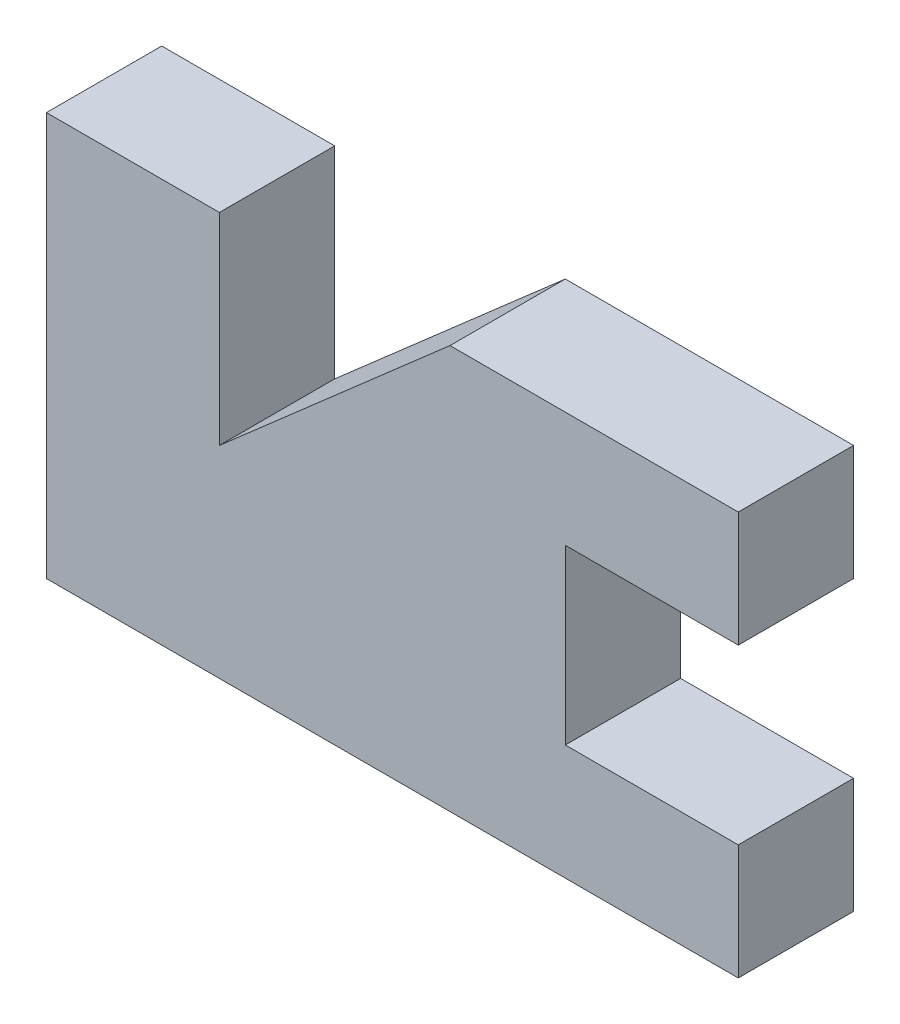
from build123d import *

# Parameters (mm, degrees)
BOSS_EXTRUDE1_DEPTH = 100


with BuildPart() as part:
    # Sketch1 → Boss-Extrude1 (new body)
    with BuildSketch(Plane.XY):
        Polygon((300, 75), (150, 75), (150, -75), (300, -75), (300, -175), (-300, -175), (-300, 175), (-150, 175), (-150, 0), (50, 175), (300, 175), align=None)
    extrude(amount=BOSS_EXTRUDE1_DEPTH)


solid = part.part
